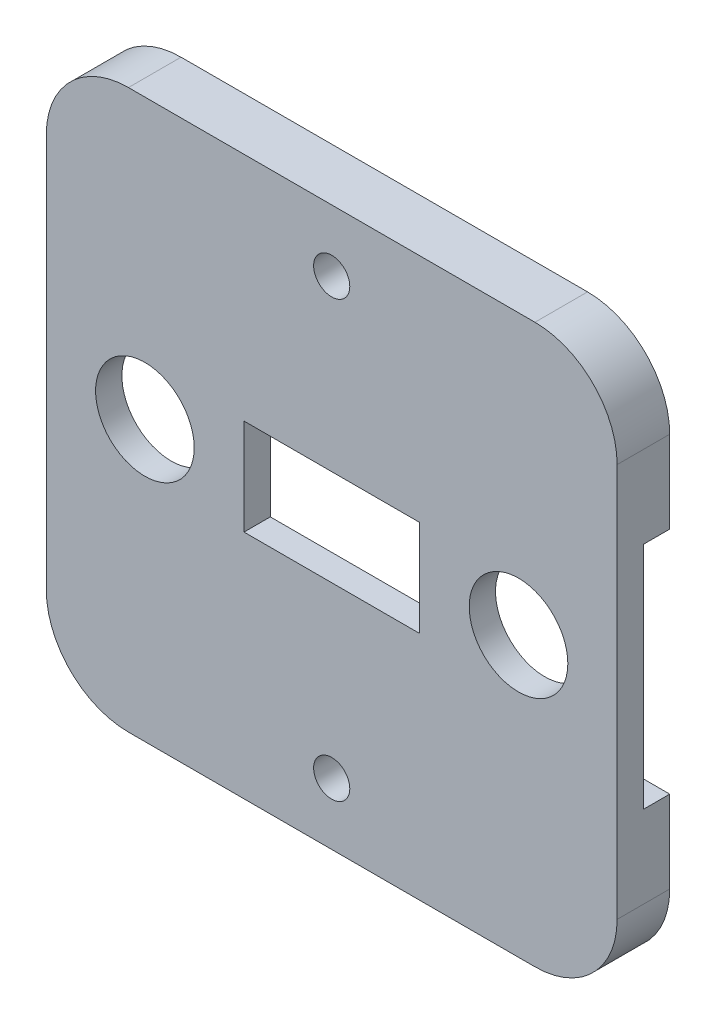
from build123d import *

# Parameters (mm, degrees)
BOSS_EXTRUDE1_DEPTH   = 4.064
BOSS_EXTRUDE1_2_DEPTH = 4.064
SKETCH2_W             = 44.1071
SKETCH2_H             = 24.0792
SKETCH2_R             = 3.81
BOSS_EXTRUDE2_DEPTH   = 2.032
F_3_CLEARANCE_HOLE1_D = 2.794


with BuildPart() as part:
    # Sketch1 → Boss-Extrude1 (new body)
    with BuildSketch(Plane.XY):
        with BuildLine():
            Line((-22.05355, -18.6229), (-22.05355, -12.2729))
            ThreePointArc((-22.05355, -12.2729), (-20.193678061, -7.782771939), (-15.70355, -5.9229))
            Line((-15.70355, -5.9229), (15.70355, -5.9229))
            ThreePointArc((15.70355, -5.9229), (20.193678061, -7.782771939), (22.05355, -12.2729))
            Line((22.05355, -12.2729), (22.05355, -18.6229))
            Line((22.05355, -18.6229), (-22.05355, -18.6229))
        make_face()
    extrude(amount=BOSS_EXTRUDE1_DEPTH)



with BuildPart() as body_2:
    # Sketch1 → Boss-Extrude1 2 (new body)
    with BuildSketch(Plane.XY):
        with BuildLine():
            Line((-22.05355, -36.3521), (22.05355, -36.3521))
            Line((22.05355, -36.3521), (22.05355, -42.7021))
            ThreePointArc((22.05355, -42.7021), (20.193678061, -47.192228061), (15.70355, -49.0521))
            Line((15.70355, -49.0521), (-15.70355, -49.0521))
            ThreePointArc((-15.70355, -49.0521), (-20.193678061, -47.192228061), (-22.05355, -42.7021))
            Line((-22.05355, -42.7021), (-22.05355, -36.3521))
        make_face()
    extrude(amount=BOSS_EXTRUDE1_2_DEPTH)


with BuildPart() as part_1:
    add(part.part)

    add(body_2.part)  # Boss-Extrude2 merges body 2
    # Sketch2 → Boss-Extrude2 (add)
    with BuildSketch(Plane.XY.offset(4.064)):
        with Locations((0, -27.4875)):
            Rectangle(SKETCH2_W, SKETCH2_H)
        with Locations((14.43355, -27.4875)):
            Circle(SKETCH2_R, mode=Mode.SUBTRACT)
        with Locations((-14.43355, -27.4875)):
            Circle(SKETCH2_R, mode=Mode.SUBTRACT)
        Polygon((-6.77545, -23.77275), (-6.77545, -24.71255), (-6.77545, -30.26245), (-6.77545, -31.20225), (6.77545, -31.20225), (6.77545, -23.77275), align=None, mode=Mode.SUBTRACT)
    extrude(amount=-BOSS_EXTRUDE2_DEPTH)

    # #3 Clearance Hole1 (through all)
    with Locations(Plane.XY.offset(4.064)):
        with Locations((0, -10.6854), (0, -44.2896)):
            Hole(F_3_CLEARANCE_HOLE1_D / 2)


solid = part_1.part
